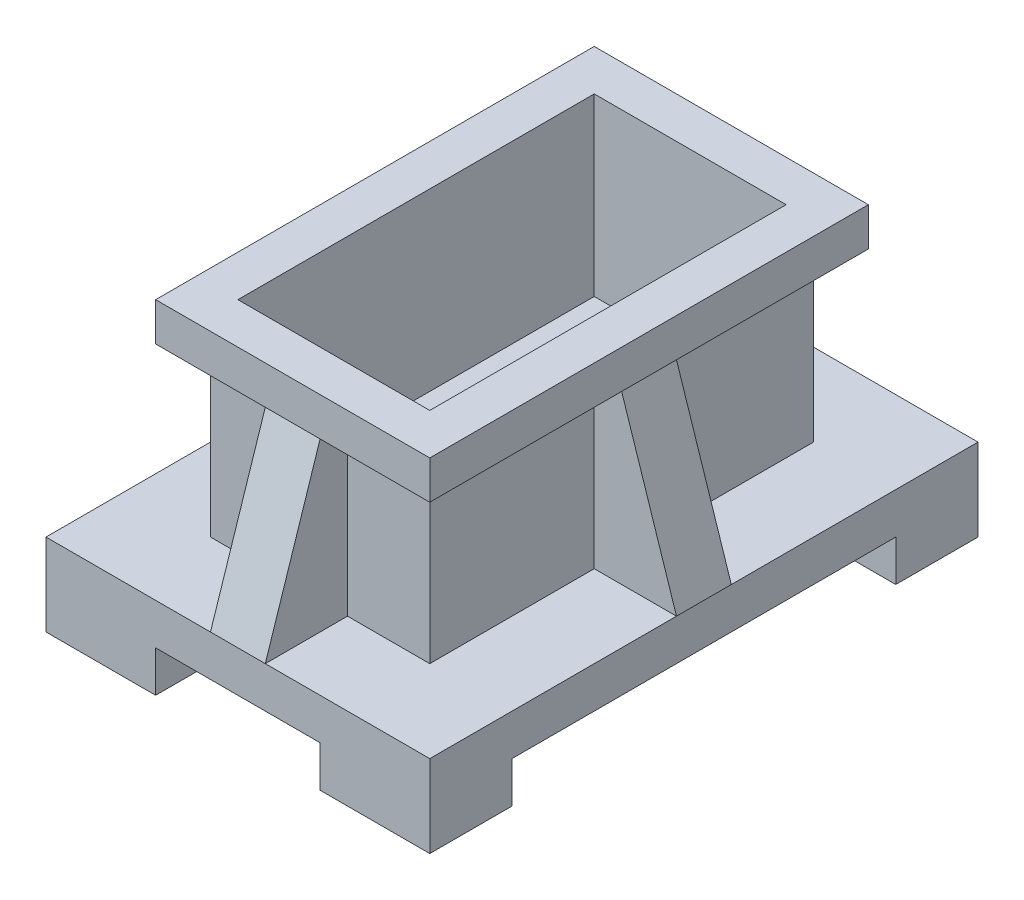
from build123d import *

# Parameters (mm, degrees)
SKETCH2_W           = 140
SKETCH2_H           = 200
BOSS_EXTRUDE1_DEPTH = 30
SKETCH3_W           = 60
SKETCH3_H           = 15
CUT_EXTRUDE1_DEPTH  = 215.00934559
SKETCH4_W           = 140
SKETCH4_H           = 15
CUT_EXTRUDE2_DEPTH  = 175.642491966
SKETCH6_W           = 80
SKETCH6_H           = 140
BOSS_EXTRUDE2_DEPTH = 61
SKETCH12_W          = 100
SKETCH12_H          = 160
SKETCH12_W_2        = 70
SKETCH12_H_2        = 130
BOSS_EXTRUDE3_DEPTH = 14
SKETCH15_W          = 70
SKETCH15_H          = 130
CUT_EXTRUDE3_DEPTH  = 50
BOSS_EXTRUDE4_DEPTH = 10
BOSS_EXTRUDE5_DEPTH = 10


with BuildPart() as part:
    # Sketch2 → Boss-Extrude1 (new body)
    with BuildSketch(Plane(origin=(0, 0, 0), x_dir=(1, 0, 0), z_dir=(0, 1, 0))):
        Rectangle(SKETCH2_W, SKETCH2_H)
    extrude(amount=BOSS_EXTRUDE1_DEPTH)

    # Sketch3 → Cut-Extrude1 (cut, through all)
    with BuildSketch(Plane.XY.offset(100)):
        with Locations((0, 7.5)):
            Rectangle(SKETCH3_W, SKETCH3_H)
    extrude(amount=-CUT_EXTRUDE1_DEPTH, mode=Mode.SUBTRACT)

    # Sketch4 → Cut-Extrude2 (cut, through all)
    with BuildSketch(Plane(origin=(70, 0, 0), x_dir=(0, 0, -1), z_dir=(1, 0, 0))):
        with Locations((0, 7.5)):
            Rectangle(SKETCH4_W, SKETCH4_H)
    extrude(amount=-CUT_EXTRUDE2_DEPTH, mode=Mode.SUBTRACT)

    # Sketch6 → Boss-Extrude2 (add)
    with BuildSketch(Plane(origin=(0, 30, 0), x_dir=(1, 0, 0), z_dir=(0, 1, 0))):
        Rectangle(SKETCH6_W, SKETCH6_H)
    extrude(amount=BOSS_EXTRUDE2_DEPTH)

    # Sketch12 → Boss-Extrude3 (add)
    with BuildSketch(Plane(origin=(0, 91, 0), x_dir=(1, 0, 0), z_dir=(0, 1, 0))):
        Rectangle(SKETCH12_W, SKETCH12_H)
        Rectangle(SKETCH12_W_2, SKETCH12_H_2, mode=Mode.SUBTRACT)
    extrude(amount=BOSS_EXTRUDE3_DEPTH)

    # Sketch15 → Cut-Extrude3 (cut)
    with BuildSketch(Plane(origin=(0, 91, 0), x_dir=(1, 0, 0), z_dir=(0, 1, 0))):
        Rectangle(SKETCH15_W, SKETCH15_H)
    extrude(amount=-CUT_EXTRUDE3_DEPTH, mode=Mode.SUBTRACT)

    # Sketch23 → Boss-Extrude4 (add, symmetric)
    with BuildSketch(Plane.XY):
        Polygon((-50, 91), (-70, 30), (-40, 30), (-40, 91), align=None)
    boss_extrude4 = extrude(amount=BOSS_EXTRUDE4_DEPTH, both=True)

    # Mirror1: Boss-Extrude4 across plane
    add(boss_extrude4.mirror(Plane(origin=(0, 0, 0), x_dir=(0, 0, 1), z_dir=(1, 0, 0))))

    # Sketch24 → Boss-Extrude5 (add, symmetric)
    with BuildSketch(Plane(origin=(0, 0, 0), x_dir=(0, 0, -1), z_dir=(1, 0, 0))):
        Polygon((-80, 91), (-100, 30), (-70, 30), (-70, 91), align=None)
    boss_extrude5 = extrude(amount=BOSS_EXTRUDE5_DEPTH, both=True)

    # Mirror2: Boss-Extrude5 across plane
    add(boss_extrude5.mirror(Plane.XY))


solid = part.part
